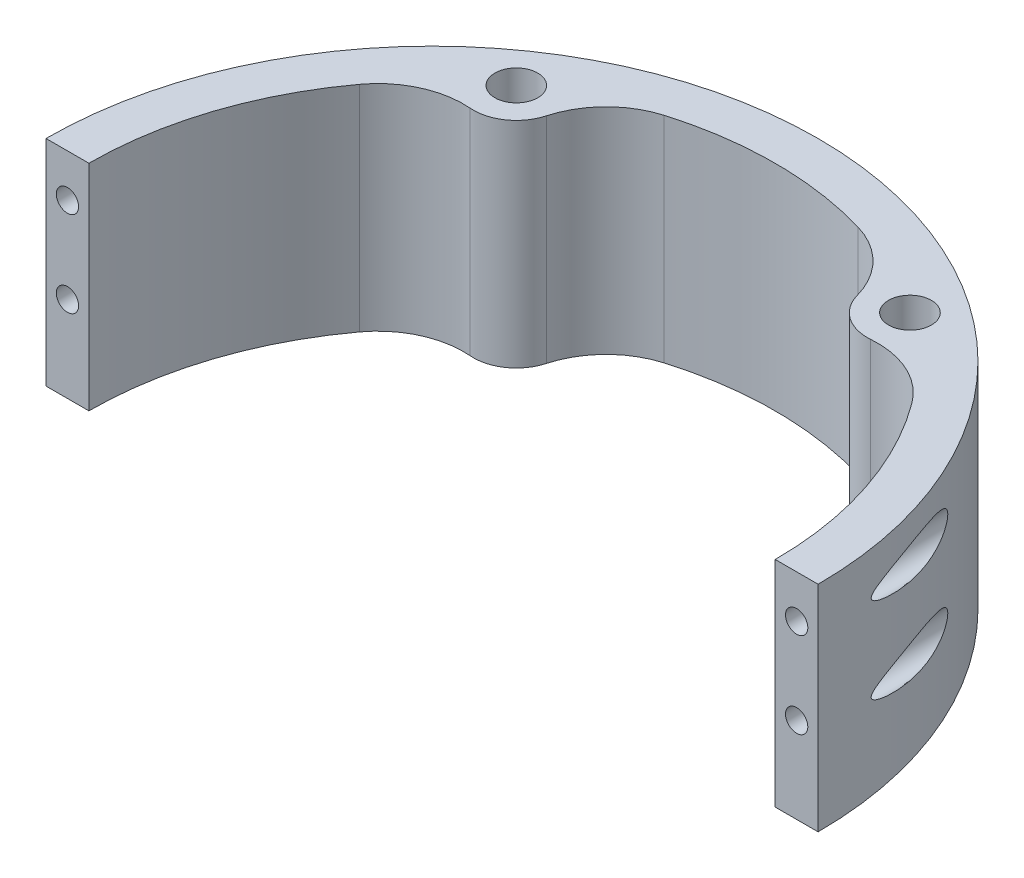
from build123d import *

# Parameters (mm, degrees)
SKETCH1_R                                      = 2.5
BOSS_EXTRUDE1_DEPTH                            = 25
CUT_EXTRUDE3_START                             = -5
SKETCH6_R                                      = 2
CUT_EXTRUDE3_DEPTH                             = 64.373971656
SKETCH7_R                                      = 1
CUT_EXTRUDE4_DEPTH                             = 69.373971824
FILLET1_R                                      = 10
CSK_FOR_M2_FLAT_HEAD_MACHINE_SCREW1_AT_2_COUNT = 2
CSK_FOR_M2_FLAT_HEAD_MACHINE_SCREW1_AT_2_PITCH = 85.586213843
CSK_FOR_M2_FLAT_HEAD_MACHINE_SCREW2_AT_2_COUNT = 2
CSK_FOR_M2_FLAT_HEAD_MACHINE_SCREW2_AT_2_PITCH = 85.586213843


with BuildPart() as part:
    # Sketch1 → Boss-Extrude1 (new body)
    with BuildSketch(Plane(origin=(0, 0, 0), x_dir=(1, 0, 0), z_dir=(0, 1, 0))):
        with BuildLine():
            Line((-45, 0), (-40, 0))
            ThreePointArc((-40, 0), (-36.565439333, 16.216308038), (-26.85156768, 29.647821389))
            ThreePointArc((-26.85156768, 29.647821389), (-20.075175272, 28.67032155), (-18.676061955, 35.372372126))
            ThreePointArc((-18.676061955, 35.372372126), (0, 40), (18.676061955, 35.372372126))
            ThreePointArc((18.676061955, 35.372372126), (20.075175272, 28.67032155), (26.85156768, 29.647821389))
            ThreePointArc((26.85156768, 29.647821389), (36.565439333, 16.216308038), (40, 0))
            Line((40, 0), (45, 0))
            ThreePointArc((45, 0), (0, 45), (-45, 0))
        make_face()
        with Locations(Location((22.943057454, 32.766081772, 0), (0, 0, 270))):
            Circle(SKETCH1_R, mode=Mode.SUBTRACT)
        with Locations(Location((-22.943057454, 32.766081772, 0), (0, 0, 270))):
            Circle(SKETCH1_R, mode=Mode.SUBTRACT)
    extrude(amount=BOSS_EXTRUDE1_DEPTH)

    # Sketch6 → Cut-Extrude3 (cut, through all)
    with BuildSketch(Plane.XY.offset(CUT_EXTRUDE3_START)):
        with Locations((-42.5, 20)):
            Circle(SKETCH6_R)
        with Locations((-42.5, 10)):
            Circle(SKETCH6_R)
        with Locations((42.5, 20)):
            Circle(SKETCH6_R)
        with Locations((42.5, 10)):
            Circle(SKETCH6_R)
    extrude(amount=-CUT_EXTRUDE3_DEPTH, mode=Mode.SUBTRACT)

    # Sketch7 → Cut-Extrude4 (cut, through all)
    with BuildSketch(Plane.XY):
        with Locations((-42.5, 20)):
            Circle(SKETCH7_R)
        with Locations((-42.5, 10)):
            Circle(SKETCH7_R)
        with Locations((42.5, 10)):
            Circle(SKETCH7_R)
        with Locations((42.5, 20)):
            Circle(SKETCH7_R)
    extrude(amount=-CUT_EXTRUDE4_DEPTH, mode=Mode.SUBTRACT)

    # Fillet1
    fillet1_edges = [part.edges().sort_by_distance(p)[0] for p in [
        (26.85156768, 12.5, -29.647821389),
        (18.676061955, 12.5, -35.372372126),
        (-18.676061955, 12.5, -35.372372126),
        (-26.85156768, 12.5, -29.647821389),
    ]]
    fillet(fillet1_edges, radius=FILLET1_R)

    # Sketch17 → CSK for M2 Flat Head Machine Screw1 (revolve, cut)
    with BuildSketch(Plane(origin=(-42.5, 20, -5), x_dir=(0, 1, 0), z_dir=(1, 0, 0))):
        Polygon((0, 0), (0, 5), (1.3, 5), (1.3, 0.9), (2.2, 0), align=None)
    csk_for_m2_flat_head_machine_screw1 = revolve(axis=Axis((-42.5, 20, -11.35), (0, 0, 1)), mode=Mode.SUBTRACT)

    # CSK for M2 Flat Head Machine Screw1 at 2: CSK for M2 Flat Head Machine Screw1 ×2
    with Locations(*[Vector(0.9931506043228763, -0.11684124756739721, 0) * (i * CSK_FOR_M2_FLAT_HEAD_MACHINE_SCREW1_AT_2_PITCH) for i in range(1, CSK_FOR_M2_FLAT_HEAD_MACHINE_SCREW1_AT_2_COUNT)]):
        add(csk_for_m2_flat_head_machine_screw1, mode=Mode.SUBTRACT)

    # Sketch18 → CSK for M2 Flat Head Machine Screw2 (revolve, cut)
    with BuildSketch(Plane(origin=(42.5, 20, -5), x_dir=(0, 1, 0), z_dir=(1, 0, 0))):
        Polygon((0, 0), (0, 5), (1.3, 5), (1.3, 0.9), (2.2, 0), align=None)
    csk_for_m2_flat_head_machine_screw2 = revolve(axis=Axis((42.5, 20, -11.35), (0, 0, 1)), mode=Mode.SUBTRACT)

    # CSK for M2 Flat Head Machine Screw2 at 2: CSK for M2 Flat Head Machine Screw2 ×2
    with Locations(*[Vector(-0.9931506043228763, -0.11684124756739721, 0) * (i * CSK_FOR_M2_FLAT_HEAD_MACHINE_SCREW2_AT_2_PITCH) for i in range(1, CSK_FOR_M2_FLAT_HEAD_MACHINE_SCREW2_AT_2_COUNT)]):
        add(csk_for_m2_flat_head_machine_screw2, mode=Mode.SUBTRACT)


solid = part.part
